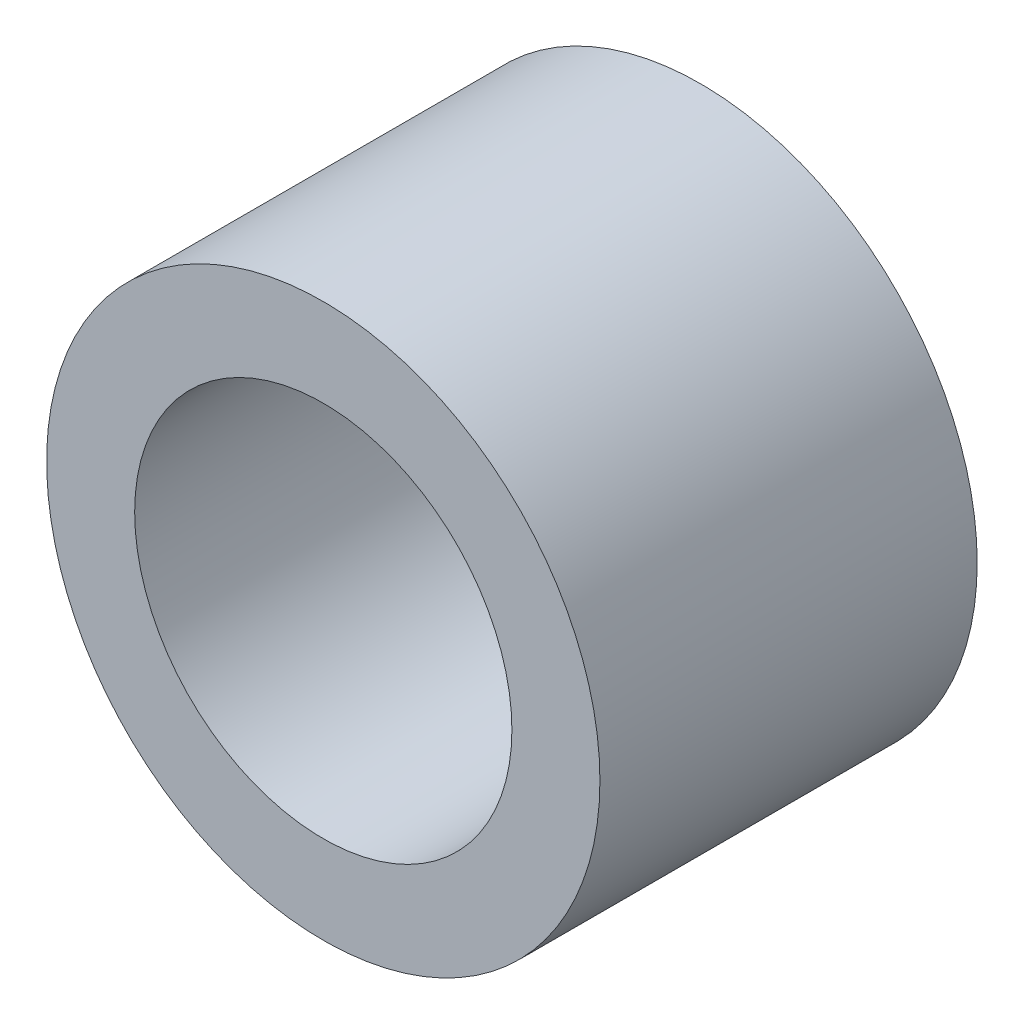
from build123d import *

# Parameters (mm, degrees)
ESQUISSE1_R        = 2.2
ESQUISSE1_R_2      = 1.5
BOSS_EXTRU_1_DEPTH = 3


with BuildPart() as part:
    # Esquisse1 → Boss.-Extru.1 (new body)
    with BuildSketch(Plane.XY):
        Circle(ESQUISSE1_R)
        Circle(ESQUISSE1_R_2, mode=Mode.SUBTRACT)
    extrude(amount=BOSS_EXTRU_1_DEPTH)


solid = part.part
